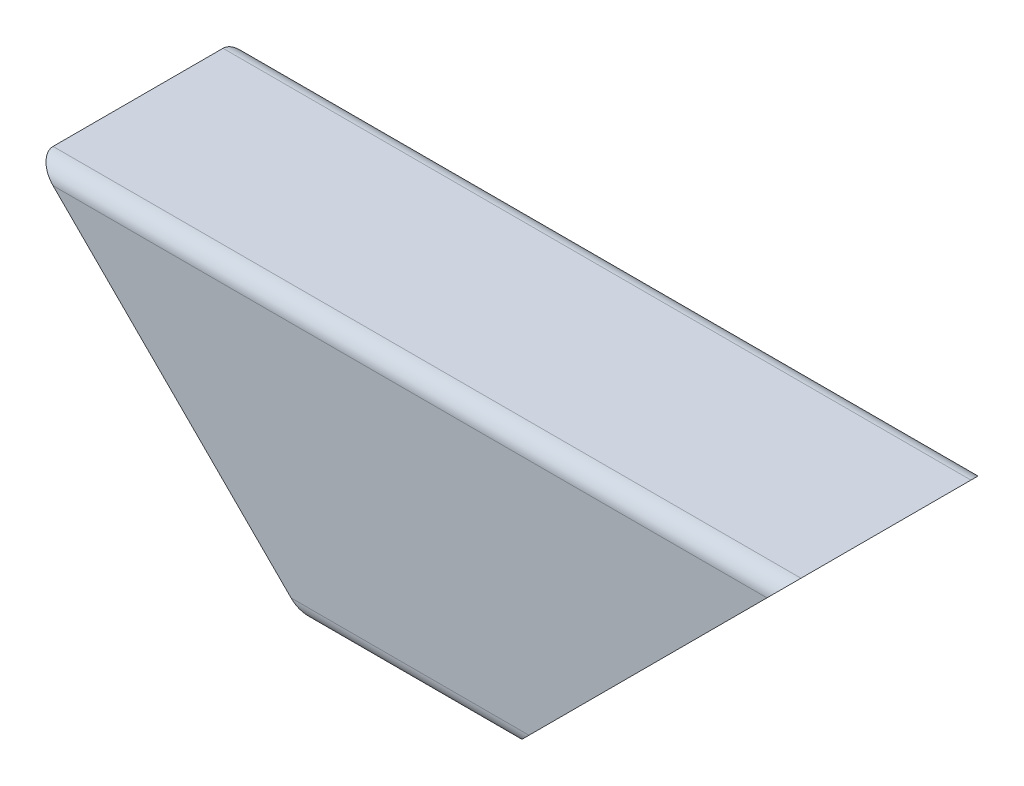
from build123d import *

# Parameters (mm, degrees)
EXTRUDE_THIN2_DEPTH = 139.7
CUT_EXTRUDE1_DEPTH  = 150.568174674


with BuildPart() as part:
    # Sketch1 → Extrude-Thin2 (new body)
    with BuildSketch(Plane(origin=(0, 0, 0), x_dir=(0, 0, -1), z_dir=(1, 0, 0))):
        with BuildLine():
            Line((-39.935482404, 37.455825651), (-71.685482404, 37.455825651))
            ThreePointArc((-71.685482404, 37.455825651), (-73.930546435, 36.525889681), (-74.860482404, 34.280825651))
            Line((-74.860482404, 34.280825651), (-74.860482404, -10.169174349))
            ThreePointArc((-74.860482404, -10.169174349), (-73.930546435, -12.414238379), (-71.685482404, -13.344174349))
            Line((-71.685482404, -13.344174349), (-39.935482404, -13.344174349))
            ThreePointArc((-39.935482404, -13.344174349), (-37.690418374, -12.414238379), (-36.760482404, -10.169174349))
            Line((-36.760482404, -10.169174349), (-36.760482404, 34.280825651))
            ThreePointArc((-36.760482404, 34.280825651), (-37.690418374, 36.525889681), (-39.935482404, 37.455825651))
        make_face()
        with BuildLine():
            Line((-39.935482404, 35.804825651), (-71.685482404, 35.804825651))
            ThreePointArc((-71.685482404, 35.804825651), (-72.763113139, 35.358456386), (-73.209482404, 34.280825651))
            Line((-73.209482404, 34.280825651), (-73.209482404, -10.169174349))
            ThreePointArc((-73.209482404, -10.169174349), (-72.763113139, -11.246805083), (-71.685482404, -11.693174349))
            Line((-71.685482404, -11.693174349), (-39.935482404, -11.693174349))
            ThreePointArc((-39.935482404, -11.693174349), (-38.85785167, -11.246805083), (-38.411482404, -10.169174349))
            Line((-38.411482404, -10.169174349), (-38.411482404, 34.280825651))
            ThreePointArc((-38.411482404, 34.280825651), (-38.85785167, 35.358456386), (-39.935482404, 35.804825651))
        make_face(mode=Mode.SUBTRACT)
    extrude(amount=EXTRUDE_THIN2_DEPTH)

    # Sketch3 → Cut-Extrude1 (cut, through all)
    with BuildSketch(Plane.XY.offset(74.860482404)):
        Polygon((0, 37.455825651), (0, -38.744174349), (76.2, -38.744174349), align=None)
        Polygon((139.7, 37.455825651), (81.28, -20.964174349), (139.7, -20.964174349), align=None)
    extrude(amount=-CUT_EXTRUDE1_DEPTH, mode=Mode.SUBTRACT)


solid = part.part
